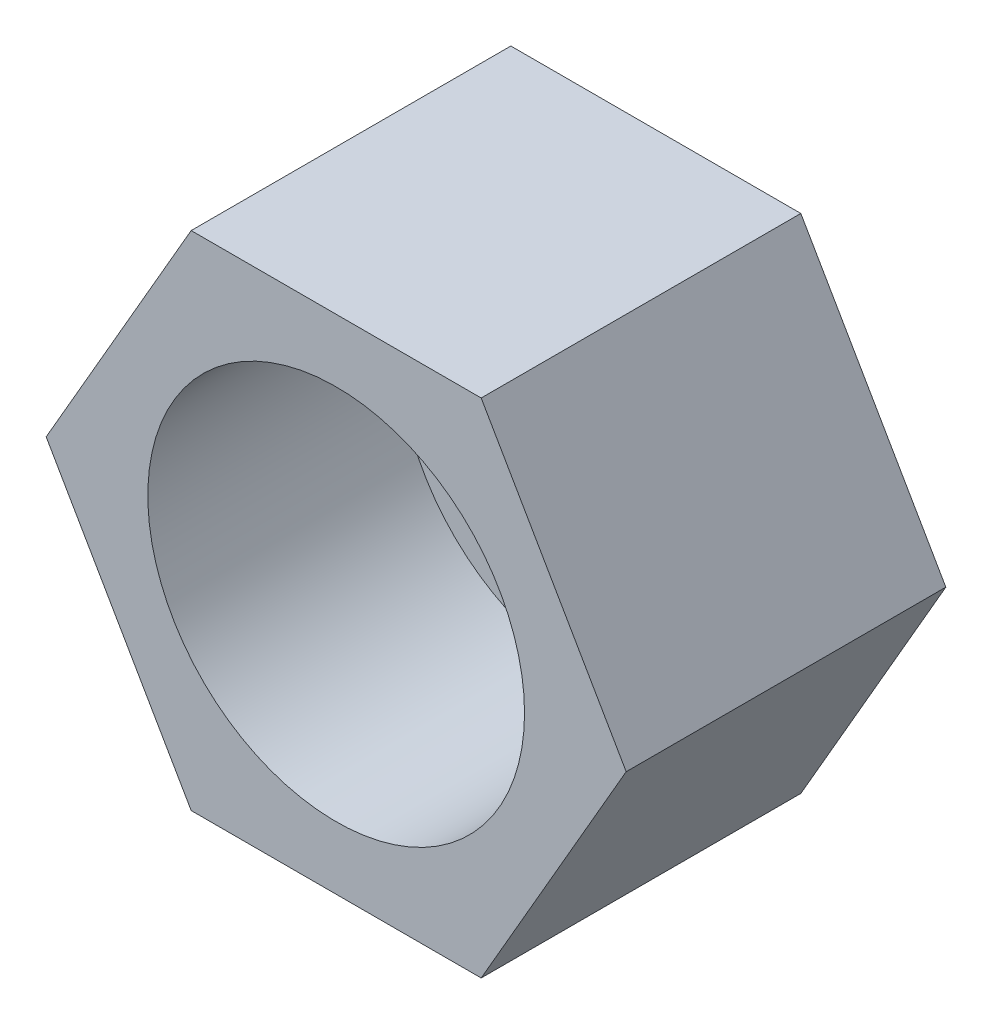
from build123d import *

# Parameters (mm, degrees)
LINEAR_AUSTRAGEN1_DEPTH         = 14
SKIZZE2_R                       = 6.9
SCHNITT_LINEAR_AUSTRAGEN1_DEPTH = 22.870832936
SKIZZE3_R                       = 8.25
SCHNITT_LINEAR_AUSTRAGEN2_DEPTH = 11


with BuildPart() as part:
    # Skizze1 → Linear austragen1 (new body)
    with BuildSketch(Plane.XY):
        Polygon((-12.701705922, 0), (-6.350852961, -11), (6.350852961, -11), (12.701705922, 0), (6.350852961, 11), (-6.350852961, 11), align=None)
    extrude(amount=LINEAR_AUSTRAGEN1_DEPTH)

    # Skizze2 → Schnitt-Linear austragen1 (cut, through all)
    with BuildSketch(Plane.XY.offset(14)):
        Circle(SKIZZE2_R)
    extrude(amount=-SCHNITT_LINEAR_AUSTRAGEN1_DEPTH, mode=Mode.SUBTRACT)

    # Skizze3 → Schnitt-Linear austragen2 (cut)
    with BuildSketch(Plane.XY.offset(14)):
        Circle(SKIZZE3_R)
    extrude(amount=-SCHNITT_LINEAR_AUSTRAGEN2_DEPTH, mode=Mode.SUBTRACT)


solid = part.part
